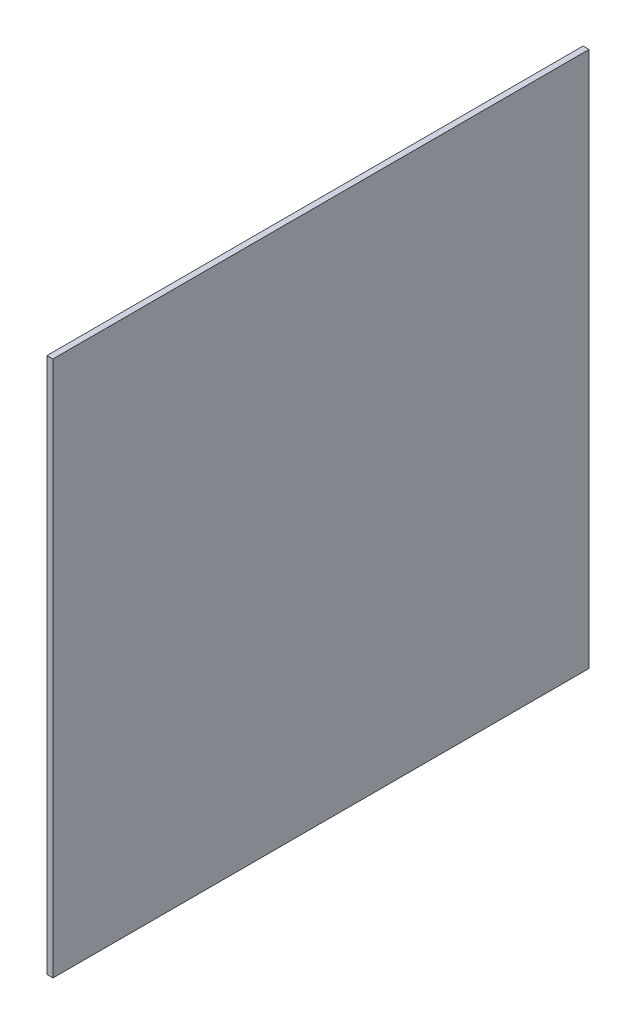
from build123d import *

# Parameters (mm, degrees)
BOSS_EXTRUDE1_DEPTH      = 3.175
BOSS_EXTRUDE1_DEPTH_BACK = 3.175
SKETCH3_W                = 571.5
SKETCH3_H                = 571.5


with BuildPart() as part:
    # Sketch3 → Boss-Extrude1 (new, two sides: drawn at the far end of the back side and taken through both)
    with BuildSketch(Plane(origin=(0, 0, 0), x_dir=(0, 0, -1), z_dir=(1, 0, 0)).offset(-BOSS_EXTRUDE1_DEPTH_BACK)):
        Rectangle(SKETCH3_W, SKETCH3_H)
    extrude(amount=BOSS_EXTRUDE1_DEPTH + BOSS_EXTRUDE1_DEPTH_BACK)


solid = part.part
